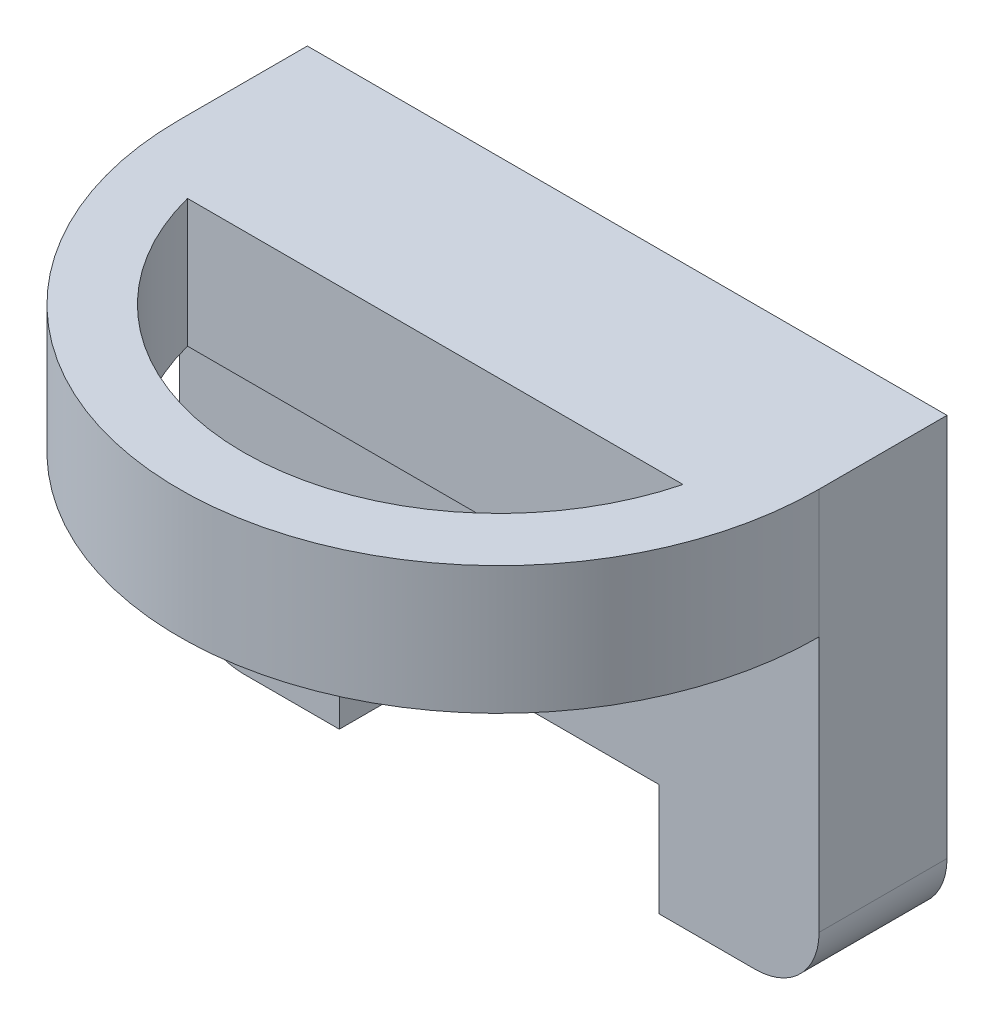
from build123d import *

# Parameters (mm, degrees)
EXTRUDE_1_DEPTH = 20
EXTRUDE_2_DEPTH = 20


with BuildPart() as part:
    # 草圖1 → 填料-伸長1 (new body)
    with BuildSketch(Plane.XY):
        with BuildLine():
            Line((25, -35), (40, -35))
            ThreePointArc((40, -35), (47.071067812, -32.071067812), (50, -25))
            Line((50, -25), (50, 35))
            Line((50, 35), (-50, 35))
            Line((-50, 35), (-50, -25))
            ThreePointArc((-50, -25), (-47.071067812, -32.071067812), (-40, -35))
            Line((-40, -35), (-25, -35))
            Line((-25, -35), (-25, -17.5))
            Line((-25, -17.5), (25, -17.5))
            Line((25, -17.5), (25, -35))
        make_face()
    extrude(amount=EXTRUDE_1_DEPTH)

    # 草圖2 → 填料-伸長2 (add)
    with BuildSketch(Plane(origin=(0, 35, 0), x_dir=(1, 0, 0), z_dir=(0, 1, 0))):
        with BuildLine():
            Line((50, -20), (-50, -20))
            ThreePointArc((-50, -20), (0, -70), (50, -20))
        make_face()
        with BuildLine():
            Line((-38.729833462, -30), (38.729833462, -30))
            ThreePointArc((38.729833462, -30), (0, -60), (-38.729833462, -30))
        make_face(mode=Mode.SUBTRACT)
    extrude(amount=-EXTRUDE_2_DEPTH)


solid = part.part
